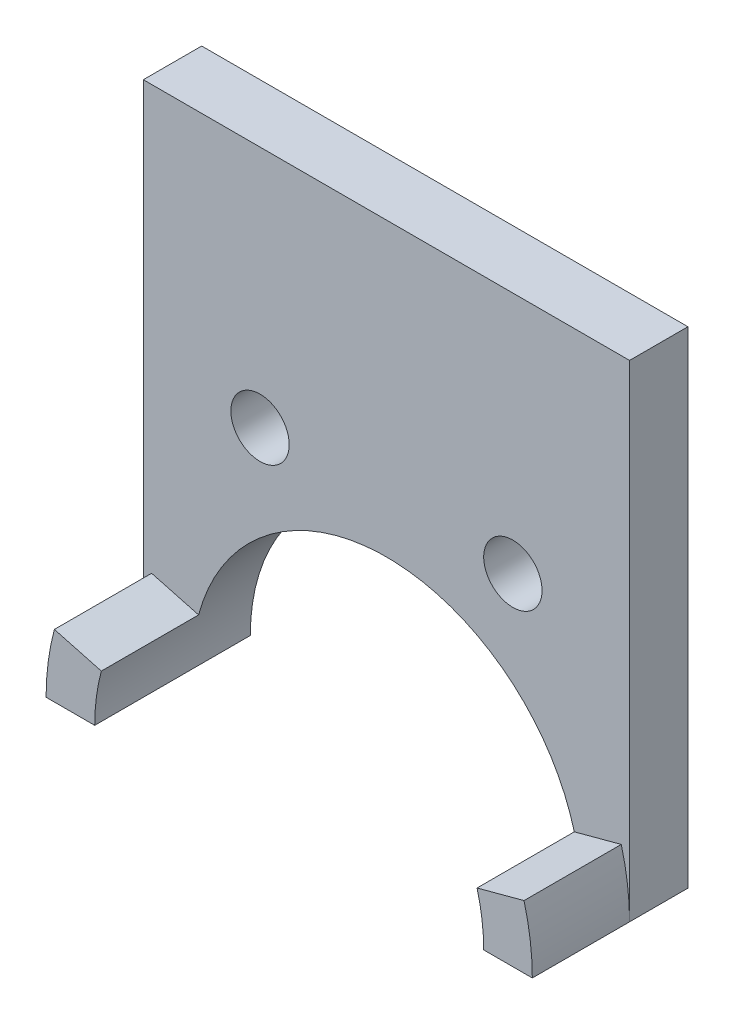
from build123d import *

# Parameters (mm, degrees)
BOSS_EXTRUDE1_DEPTH = 6
BOSS_EXTRUDE2_DEPTH = 10
BOSS_EXTRUDE3_DEPTH = 6
SKETCH4_R           = 3
CUT_EXTRUDE1_DEPTH  = 57.789083458


with BuildPart() as part:
    # Sketch1 → Boss-Extrude1 (new body)
    with BuildSketch(Plane.XY):
        with BuildLine():
            Line((20, 0), (25, 0))
            ThreePointArc((25, 0), (0, 25), (-25, 0))
            Line((-25, 0), (-20, 0))
            ThreePointArc((-20, 0), (0, 20), (20, 0))
        make_face()
    extrude(amount=BOSS_EXTRUDE1_DEPTH)

    # Sketch2 → Boss-Extrude2 (add)
    with BuildSketch(Plane.XY.offset(6)):
        with BuildLine():
            ThreePointArc((-20, 0), (-19.828897227, 2.610523844), (-19.318516526, 5.176380902))
            Line((-19.318516526, 5.176380902), (-24.148145657, 6.470476128))
            ThreePointArc((-24.148145657, 6.470476128), (-24.786121534, 3.263154806), (-25, 0))
            Line((-25, 0), (-20, 0))
        make_face()
        with BuildLine():
            Line((24.148145657, 6.470476128), (19.318516526, 5.176380902))
            ThreePointArc((19.318516526, 5.176380902), (19.828897227, 2.610523844), (20, 0))
            Line((20, 0), (25, 0))
            ThreePointArc((25, 0), (24.786121534, 3.263154806), (24.148145657, 6.470476128))
        make_face()
    extrude(amount=BOSS_EXTRUDE2_DEPTH)

    # Sketch3 → Boss-Extrude3 (add)
    with BuildSketch(Plane(origin=(0, 0, 0), x_dir=(-1, 0, 0), z_dir=(0, 0, -1))):
        with BuildLine():
            Line((-25, 0), (-25, 50))
            Line((-25, 50), (25, 50))
            Line((25, 50), (25, 0))
            ThreePointArc((25, 0), (0, 25), (-25, 0))
        make_face()
    extrude(amount=-BOSS_EXTRUDE3_DEPTH)

    # Sketch4 → Cut-Extrude1 (cut, through all)
    with BuildSketch(Plane.XY.offset(6)):
        with Locations((13, 25)):
            Circle(SKETCH4_R)
        with Locations((-13, 25)):
            Circle(SKETCH4_R)
    extrude(amount=-CUT_EXTRUDE1_DEPTH, mode=Mode.SUBTRACT)


solid = part.part
